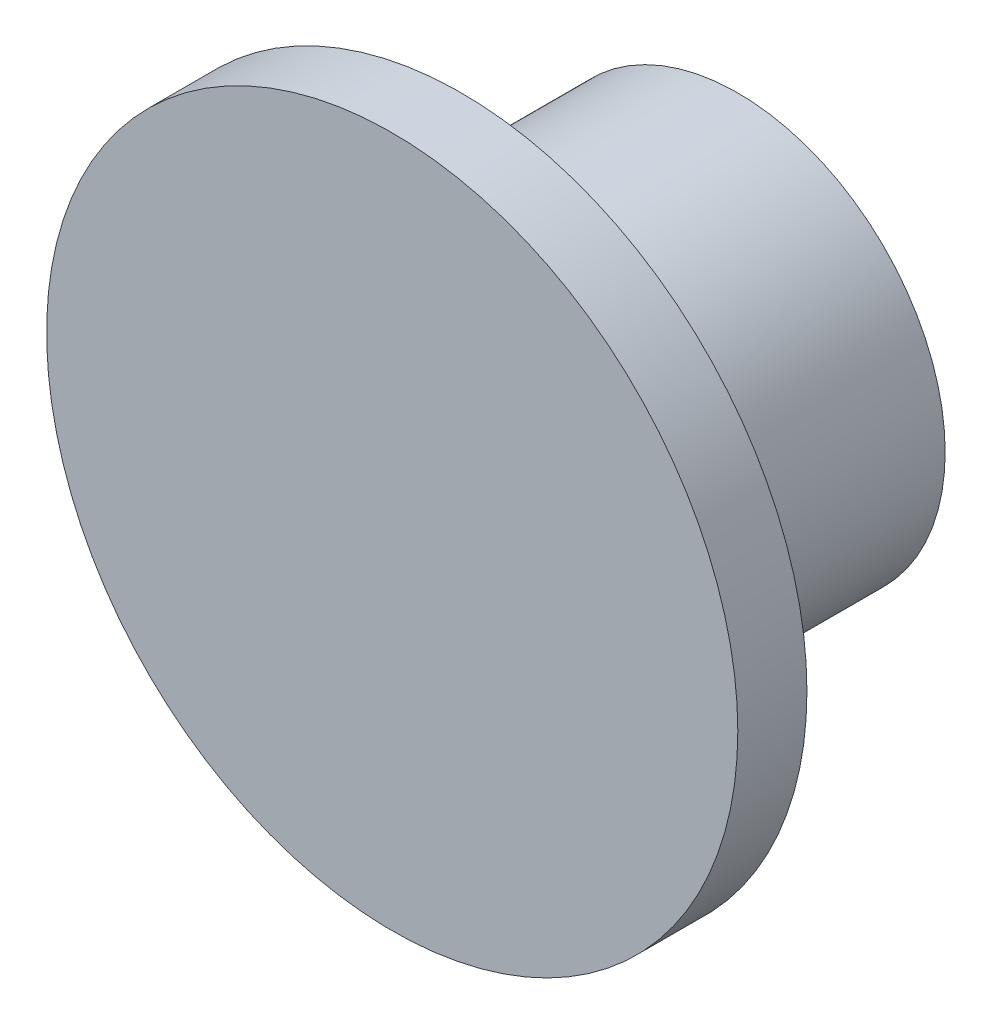
from build123d import *

# Parameters (mm, degrees)
SKETCH1_R           = 25
BOSS_EXTRUDE8_DEPTH = 5
SKETCH1_19_R        = 15
BOSS_EXTRUDE9_DEPTH = 20


with BuildPart() as part:
    # Sketch1 → Boss-Extrude8 (new body)
    with BuildSketch(Plane.XY):
        Circle(SKETCH1_R)
    extrude(amount=BOSS_EXTRUDE8_DEPTH)

    # Sketch1<19> → Boss-Extrude9 (add)
    with BuildSketch(Plane.XY):
        Circle(SKETCH1_19_R)
    extrude(amount=-BOSS_EXTRUDE9_DEPTH)


solid = part.part
